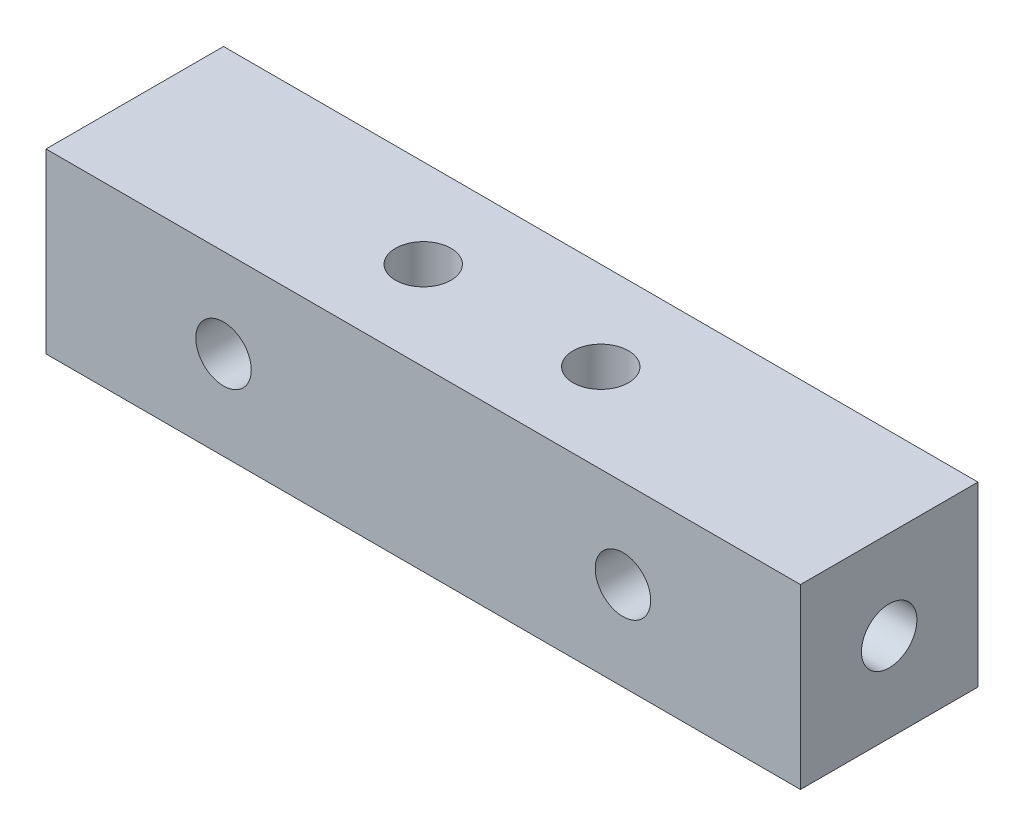
from build123d import *

# Parameters (mm, degrees)
SKETCH_1_W         = 34
SKETCH_1_H         = 8
EXTRUDE_1_DEPTH    = 8
HOLE_WIZARD_M3_2_D = 2.5
HOLE_WIZARD_M3_3_D = 2.5
HOLE_WIZARD_M3_4_D = 2.5
HOLE_WIZARD_M3_5_D = 2.5
HOLE_WIZARD_M3_6_D = 2.5


with BuildPart() as part:
    # 草图1 → 凸台-拉伸1 (new body)
    with BuildSketch(Plane.XY):
        Rectangle(SKETCH_1_W, SKETCH_1_H)
    extrude(amount=EXTRUDE_1_DEPTH)

    # M3 螺纹孔的螺纹孔钻头2 (through all)
    with Locations(Plane(origin=(17, 0, 4.003653537), x_dir=(0, 0, 1), z_dir=(1, 0, 0))):
        with Locations((0, 0)):
            Hole(HOLE_WIZARD_M3_2_D / 2)

    # M3 螺纹孔的螺纹孔钻头3 (through all)
    with Locations(Plane(origin=(-9, 0, 8), x_dir=(1, 0, 0), z_dir=(0, 0, 1))):
        with Locations((0, 0)):
            Hole(HOLE_WIZARD_M3_3_D / 2)

    # M3 螺纹孔的螺纹孔钻头4 (through all)
    with Locations(Plane(origin=(9, 0, 8), x_dir=(1, 0, 0), z_dir=(0, 0, 1))):
        with Locations((0, 0)):
            Hole(HOLE_WIZARD_M3_4_D / 2)

    # M3 螺纹孔的螺纹孔钻头5 (through all)
    with Locations(Plane(origin=(-4, 4, 4), x_dir=(1, 0, 0), z_dir=(0, 1, 0))):
        with Locations((0, 0)):
            Hole(HOLE_WIZARD_M3_5_D / 2)

    # M3 螺纹孔的螺纹孔钻头6 (through all)
    with Locations(Plane(origin=(4, 4, 4), x_dir=(1, 0, 0), z_dir=(0, 1, 0))):
        with Locations((0, 0)):
            Hole(HOLE_WIZARD_M3_6_D / 2)


solid = part.part
